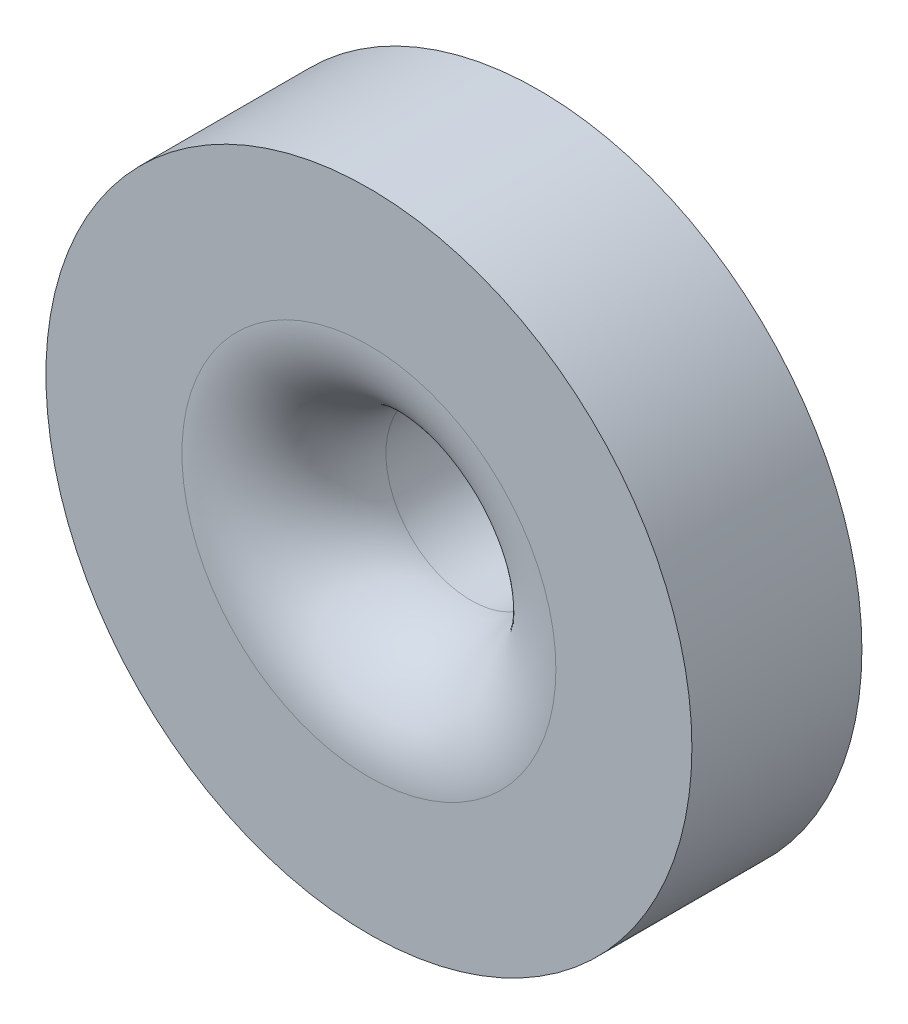
from build123d import *

# Parameters (mm, degrees)
SKETCH1_R           = 9.5
BOSS_EXTRUDE1_DEPTH = 5
SKETCH2_R           = 2.5
CUT_EXTRUDE1_DEPTH  = 5
FILLET1_R           = 3


with BuildPart() as part:
    # Sketch1 → Boss-Extrude1 (new body)
    with BuildSketch(Plane.XY):
        Circle(SKETCH1_R)
    extrude(amount=BOSS_EXTRUDE1_DEPTH)

    # Sketch2 → Cut-Extrude1 (cut)
    with BuildSketch(Plane.XY.offset(5)):
        Circle(SKETCH2_R)
    extrude(amount=-CUT_EXTRUDE1_DEPTH, mode=Mode.SUBTRACT)

    # Fillet1
    fillet1_edges = [part.edges().sort_by_distance(p)[0] for p in [
        (-2.5, 0, 5),
    ]]
    fillet(fillet1_edges, radius=FILLET1_R)


solid = part.part
